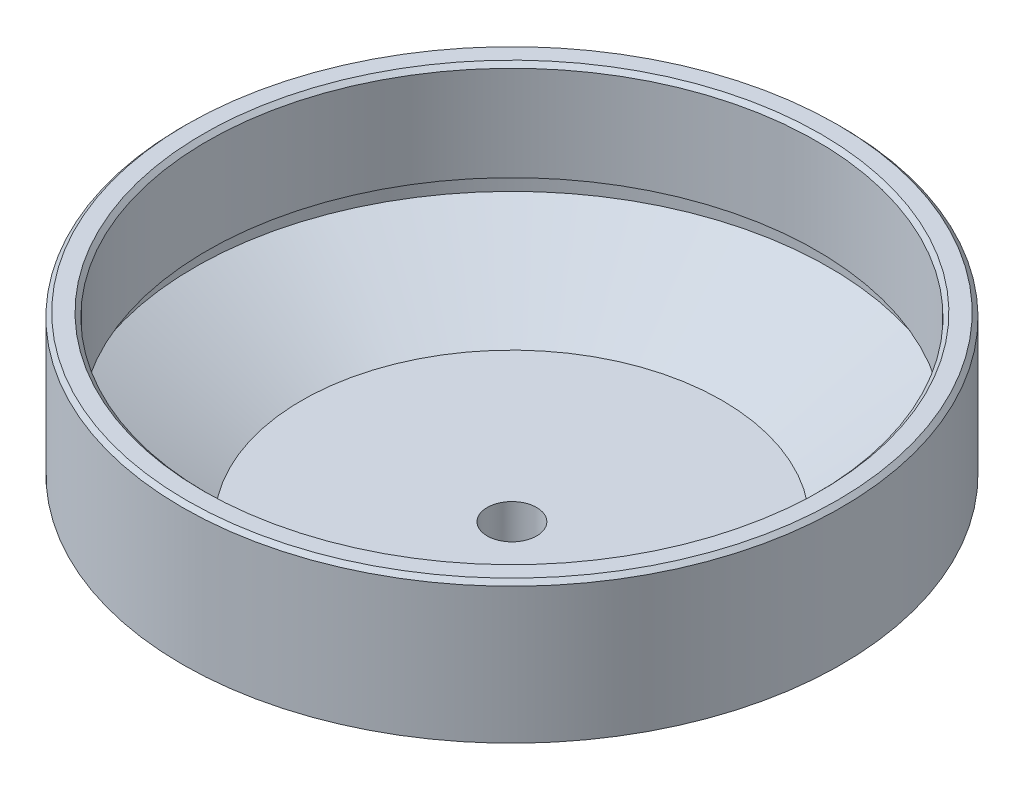
from build123d import *

# Parameters (mm, degrees)
CHAMFER_1_SIZE = 0.5


with BuildPart() as part:
    # Эскиз1 → Повернуть1 (revolve)
    with BuildSketch(Plane.XY):
        Polygon((-40, 28), (-40, 11), (-20.947441117, 0), (-3, 0), (-3, 6), (-25.509618943, 6), (-38.5, 13.5), (-38.5, 16), (-37, 16), (-37, 28), align=None)
    revolve(axis=Axis((0, 26.168985987, 0), (0, -1, 0)))

    # Фаска1
    chamfer_1_edges = [part.edges().sort_by_distance(p)[0] for p in [
        (3, 0, 0),
        (40, 28, 0),
        (37, 28, 0),
    ]]
    chamfer(chamfer_1_edges, length=CHAMFER_1_SIZE)


solid = part.part
